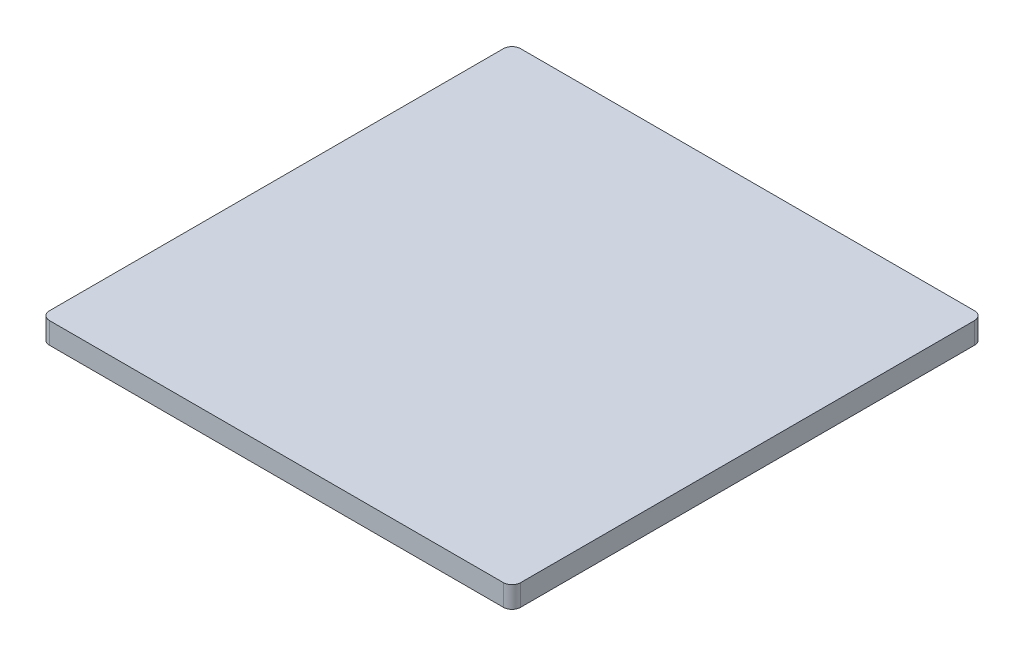
from build123d import *

# Parameters (mm, degrees)
EXTRUDE_1_DEPTH = 2.5


with BuildPart() as part:
    # 草图1 → 凸台-拉伸1 (new body)
    with BuildSketch(Plane(origin=(0, 0, 0), x_dir=(1, 0, 0), z_dir=(0, 1, 0))):
        with BuildLine():
            Line((1, 0), (54, 0))
            ThreePointArc((54, 0), (54.707106781, 0.292893219), (55, 1))
            Line((55, 1), (55, 54))
            ThreePointArc((55, 54), (54.707106781, 54.707106781), (54, 55))
            Line((54, 55), (1, 55))
            ThreePointArc((1, 55), (0.292893219, 54.707106781), (0, 54))
            Line((0, 54), (0, 1))
            ThreePointArc((0, 1), (0.292893219, 0.292893219), (1, 0))
        make_face()
    extrude(amount=EXTRUDE_1_DEPTH)


solid = part.part
